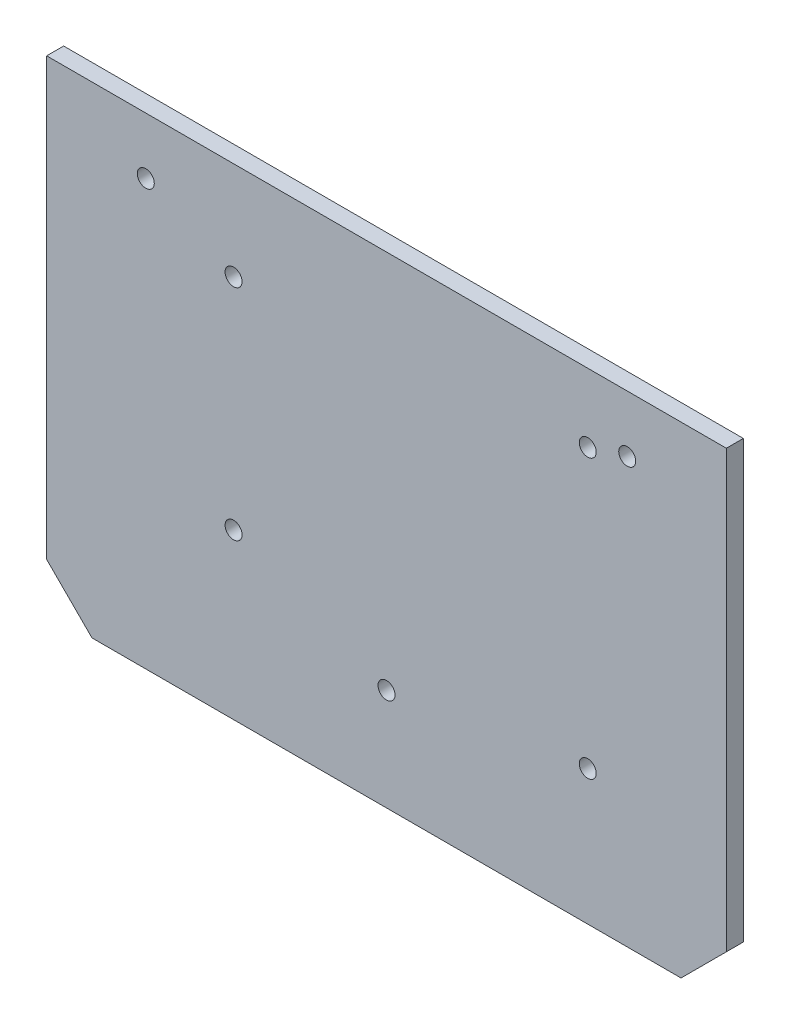
from build123d import *

# Parameters (mm, degrees)
SKETCH_1_W          = 120
SKETCH_1_H          = 85
EXTRUDE_1_DEPTH     = 3
SKETCH_2_R          = 1.5
CUT_EXTRUDE_1_DEPTH = 74.588382235
SKETCH_3_R          = 1.5
CUT_EXTRUDE_2_DEPTH = 74.588382235
CHAMFER_1_SIZE      = 8


with BuildPart() as part:
    # 草图1 → 凸台-拉伸1 (new body)
    with BuildSketch(Plane.XY):
        Rectangle(SKETCH_1_W, SKETCH_1_H)
    extrude(amount=EXTRUDE_1_DEPTH)

    # 草图2 → 切除-拉伸1 (cut, through all)
    with BuildSketch(Plane.XY.offset(3)):
        with Locations((0, -24.5)):
            Circle(SKETCH_2_R)
        with Locations((-42.5, 32.5)):
            Circle(SKETCH_2_R)
        with Locations(Location((42.5, 32.5, 0), (0, 0, 180))):
            Circle(SKETCH_2_R)
    extrude(amount=-CUT_EXTRUDE_1_DEPTH, mode=Mode.SUBTRACT)

    # 草图3 → 切除-拉伸2 (cut, through all)
    with BuildSketch(Plane.XY.offset(3)):
        with Locations((35.527993731, 30.4)):
            Circle(SKETCH_3_R)
        with Locations((-27, 25.2)):
            Circle(SKETCH_3_R)
        with Locations(Location((35.527993731, -18.7, 0), (0, 0, 180))):
            Circle(SKETCH_3_R)
        with Locations(Location((-27, -13.5, 0), (0, 0, 180))):
            Circle(SKETCH_3_R)
    extrude(amount=-CUT_EXTRUDE_2_DEPTH, mode=Mode.SUBTRACT)

    # 倒角1
    chamfer_1_edges = [part.edges().sort_by_distance(p)[0] for p in [
        (60, -42.5, 1.5),
        (-60, -42.5, 1.5),
    ]]
    chamfer(chamfer_1_edges, length=CHAMFER_1_SIZE)


solid = part.part
